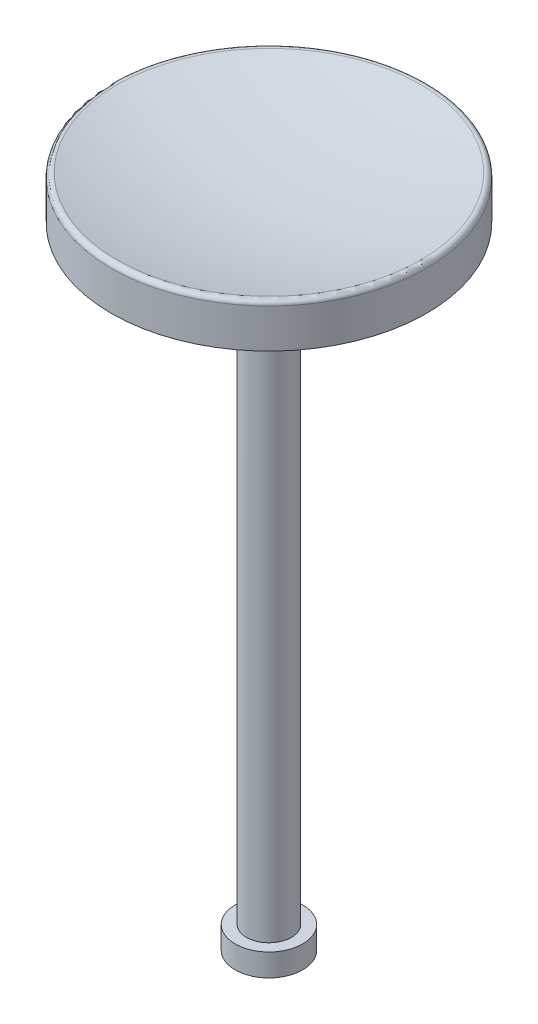
from build123d import *

# Parameters (mm, degrees)
SKETCH1_R           = 6.35
SKETCH1_R_2         = 3.175
BOSS_EXTRUDE1_DEPTH = 177.8
SKETCH7_R           = 9.525
SKETCH7_R_2         = 6.35
BOSS_EXTRUDE2_DEPTH = 6.35


with BuildPart() as part:
    # Sketch1 → Boss-Extrude1 (new body)
    with BuildSketch(Plane(origin=(0, 0, 0), x_dir=(1, 0, 0), z_dir=(0, 1, 0))):
        with Locations(Location((0, 0, 0), (0, 0, 270))):
            Circle(SKETCH1_R)
        with Locations(Location((0, 0, 0), (0, 0, 270))):
            Circle(SKETCH1_R_2, mode=Mode.SUBTRACT)
    extrude(amount=BOSS_EXTRUDE1_DEPTH)

    # Sketch6 → Revolve2 (revolve)
    with BuildSketch(Plane(origin=(0, 0, 0), x_dir=(0, 0, -1), z_dir=(1, 0, 0))):
        with BuildLine():
            Line((0, 177.8), (-44.45, 177.8))
            Line((-44.45, 177.8), (-44.45, 188.815970977))
            ThreePointArc((-44.45, 188.815970977), (-43.947356832, 189.827931199), (-42.837301587, 190.038860096))
            ThreePointArc((-42.837301587, 190.038860096), (-21.620089503, 185.629105586), (0, 184.15))
            Line((0, 184.15), (0, 177.8))
        make_face()
    revolve(axis=Axis((0, 184.15, 0), (0, -1, 0)))

    # Sketch7 → Boss-Extrude2 (add)
    with BuildSketch(Plane.XZ):
        with Locations(Location((0, 0, 0), (0, 0, 270))):
            Circle(SKETCH7_R)
        with Locations(Location((0, 0, 0), (0, 0, 270))):
            Circle(SKETCH7_R_2, mode=Mode.SUBTRACT)
    extrude(amount=-BOSS_EXTRUDE2_DEPTH)


solid = part.part
